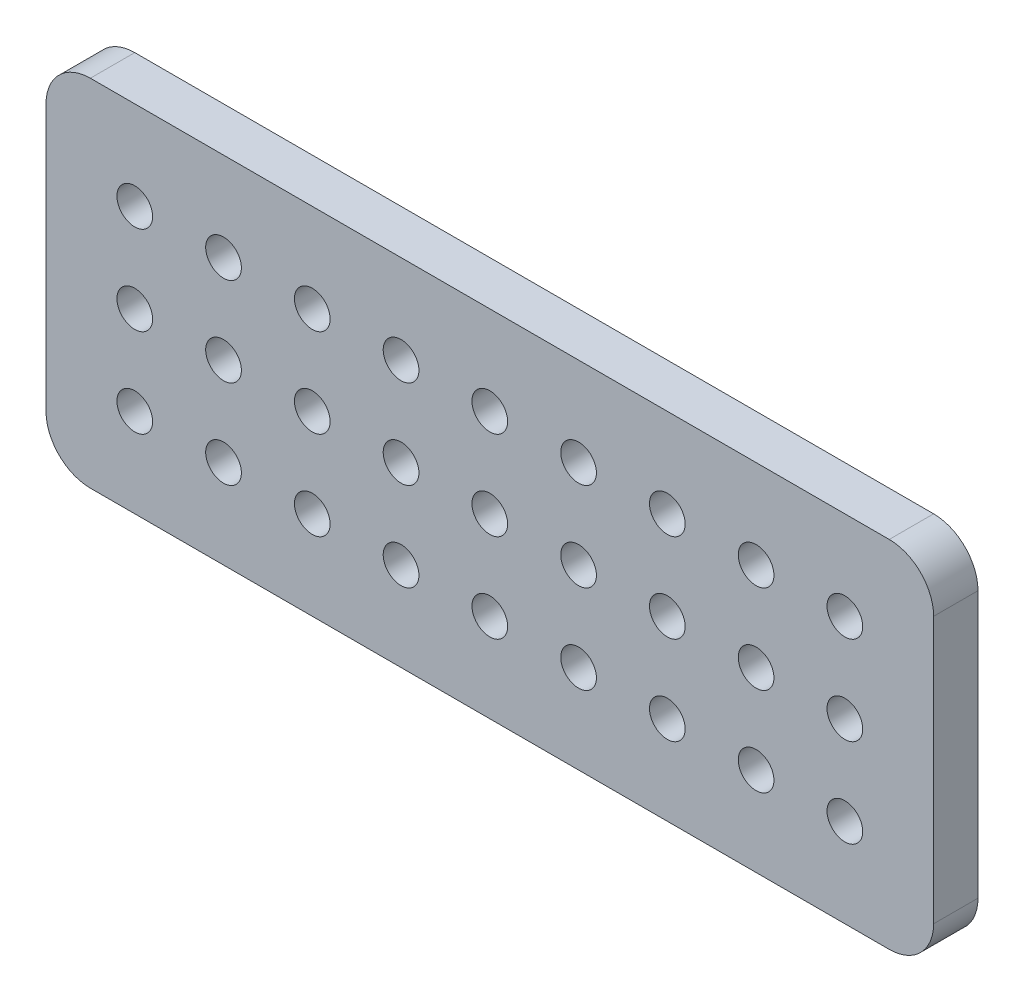
from build123d import *

# Parameters (mm, degrees)
SKETCH6_W           = 127
SKETCH6_H           = 50.8
SKETCH6_R           = 2.5527
BOSS_EXTRUDE1_DEPTH = 6.35
FILLET1_R           = 6.35


with BuildPart() as part:
    # Sketch6 → Boss-Extrude1 (new body)
    with BuildSketch(Plane.XY):
        Rectangle(SKETCH6_W, SKETCH6_H)
        with Locations((-50.8, 0)):
            Circle(SKETCH6_R, mode=Mode.SUBTRACT)
        with Locations((-50.8, 12.7)):
            Circle(SKETCH6_R, mode=Mode.SUBTRACT)
        with Locations((-50.8, -12.7)):
            Circle(SKETCH6_R, mode=Mode.SUBTRACT)
        with Locations((-38.1, -12.7)):
            Circle(SKETCH6_R, mode=Mode.SUBTRACT)
        with Locations((-38.1, 0)):
            Circle(SKETCH6_R, mode=Mode.SUBTRACT)
        with Locations((-38.1, 12.7)):
            Circle(SKETCH6_R, mode=Mode.SUBTRACT)
        with Locations((-25.4, -12.7)):
            Circle(SKETCH6_R, mode=Mode.SUBTRACT)
        with Locations((-25.4, 0)):
            Circle(SKETCH6_R, mode=Mode.SUBTRACT)
        with Locations((-25.4, 12.7)):
            Circle(SKETCH6_R, mode=Mode.SUBTRACT)
        with Locations((-12.7, -12.7)):
            Circle(SKETCH6_R, mode=Mode.SUBTRACT)
        with Locations((-12.7, 0)):
            Circle(SKETCH6_R, mode=Mode.SUBTRACT)
        with Locations((-12.7, 12.7)):
            Circle(SKETCH6_R, mode=Mode.SUBTRACT)
        with Locations((0, -12.7)):
            Circle(SKETCH6_R, mode=Mode.SUBTRACT)
        Circle(SKETCH6_R, mode=Mode.SUBTRACT)
        with Locations((0, 12.7)):
            Circle(SKETCH6_R, mode=Mode.SUBTRACT)
        with Locations((12.7, -12.7)):
            Circle(SKETCH6_R, mode=Mode.SUBTRACT)
        with Locations((12.7, 0)):
            Circle(SKETCH6_R, mode=Mode.SUBTRACT)
        with Locations((12.7, 12.7)):
            Circle(SKETCH6_R, mode=Mode.SUBTRACT)
        with Locations((25.4, -12.7)):
            Circle(SKETCH6_R, mode=Mode.SUBTRACT)
        with Locations((25.4, 0)):
            Circle(SKETCH6_R, mode=Mode.SUBTRACT)
        with Locations((25.4, 12.7)):
            Circle(SKETCH6_R, mode=Mode.SUBTRACT)
        with Locations((38.1, -12.7)):
            Circle(SKETCH6_R, mode=Mode.SUBTRACT)
        with Locations((38.1, 0)):
            Circle(SKETCH6_R, mode=Mode.SUBTRACT)
        with Locations((38.1, 12.7)):
            Circle(SKETCH6_R, mode=Mode.SUBTRACT)
        with Locations((50.8, -12.7)):
            Circle(SKETCH6_R, mode=Mode.SUBTRACT)
        with Locations((50.8, 0)):
            Circle(SKETCH6_R, mode=Mode.SUBTRACT)
        with Locations((50.8, 12.7)):
            Circle(SKETCH6_R, mode=Mode.SUBTRACT)
    extrude(amount=BOSS_EXTRUDE1_DEPTH)

    # Fillet1
    fillet1_edges = [part.edges().sort_by_distance(p)[0] for p in [
        (63.5, -25.4, 3.175),
        (-63.5, -25.4, 3.175),
        (-63.5, 25.4, 3.175),
        (63.5, 25.4, 3.175),
    ]]
    fillet(fillet1_edges, radius=FILLET1_R)


solid = part.part
